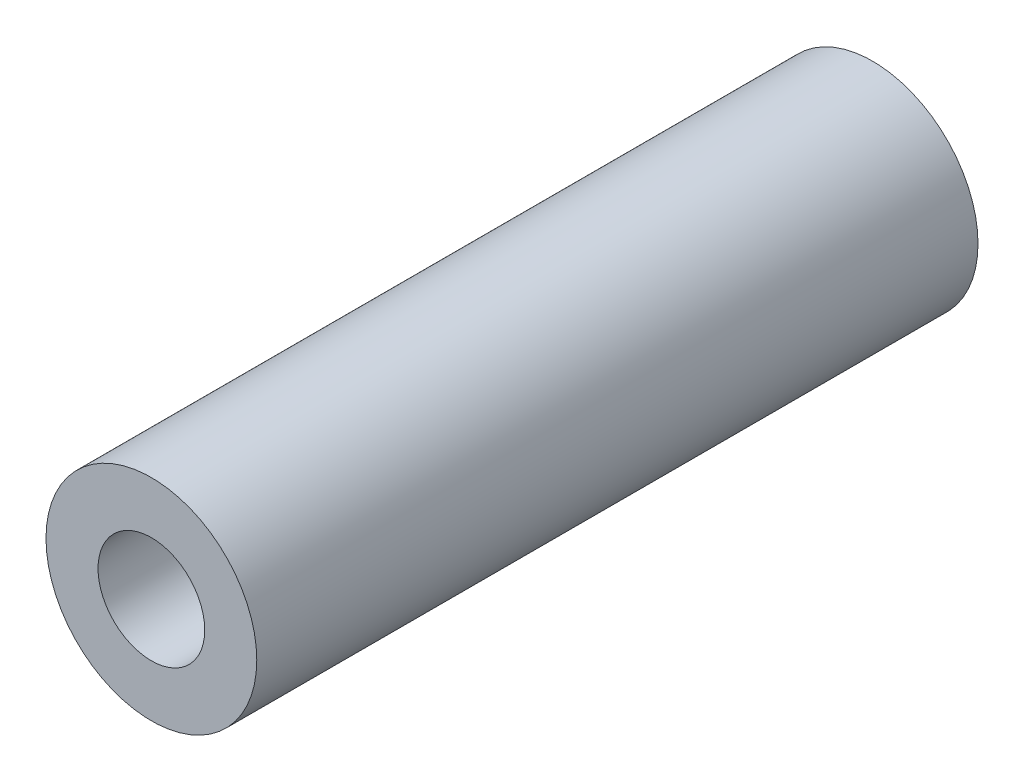
from build123d import *

# Parameters (mm, degrees)
F_01_START                               = -1.5
S01_SOLID_POST_BLANK_16_MM_R             = 8
F_01_SOLID_POST_BLANK_16_MM_DEPTH        = 54.75
F_02_START                               = -1.6
S02_REAR_M6_HEAT_SET_INSERT_SEAT_R       = 4.05
F_02_REAR_M6_HEAT_SET_INSERT_SEAT_DEPTH  = 14.35
F_03_START                               = 39
S03_FRONT_M6_HEAT_SET_INSERT_SEAT_R      = 4.05
F_03_FRONT_M6_HEAT_SET_INSERT_SEAT_DEPTH = 14.35


with BuildPart() as part:
    # S01 - Solid post blank - 16 mm → 01 - Solid post blank - 16 mm (new body)
    with BuildSketch(Plane.XY.offset(F_01_START)):
        Circle(S01_SOLID_POST_BLANK_16_MM_R)
    extrude(amount=F_01_SOLID_POST_BLANK_16_MM_DEPTH)

    # S02 - Rear M6 heat-set insert seat → 02 - Rear M6 heat-set insert seat (cut)
    with BuildSketch(Plane.XY.offset(F_02_START)):
        Circle(S02_REAR_M6_HEAT_SET_INSERT_SEAT_R)
    extrude(amount=F_02_REAR_M6_HEAT_SET_INSERT_SEAT_DEPTH, mode=Mode.SUBTRACT)

    # S03 - Front M6 heat-set insert seat → 03 - Front M6 heat-set insert seat (cut)
    with BuildSketch(Plane.XY.offset(F_03_START)):
        Circle(S03_FRONT_M6_HEAT_SET_INSERT_SEAT_R)
    extrude(amount=F_03_FRONT_M6_HEAT_SET_INSERT_SEAT_DEPTH, mode=Mode.SUBTRACT)


solid = part.part
